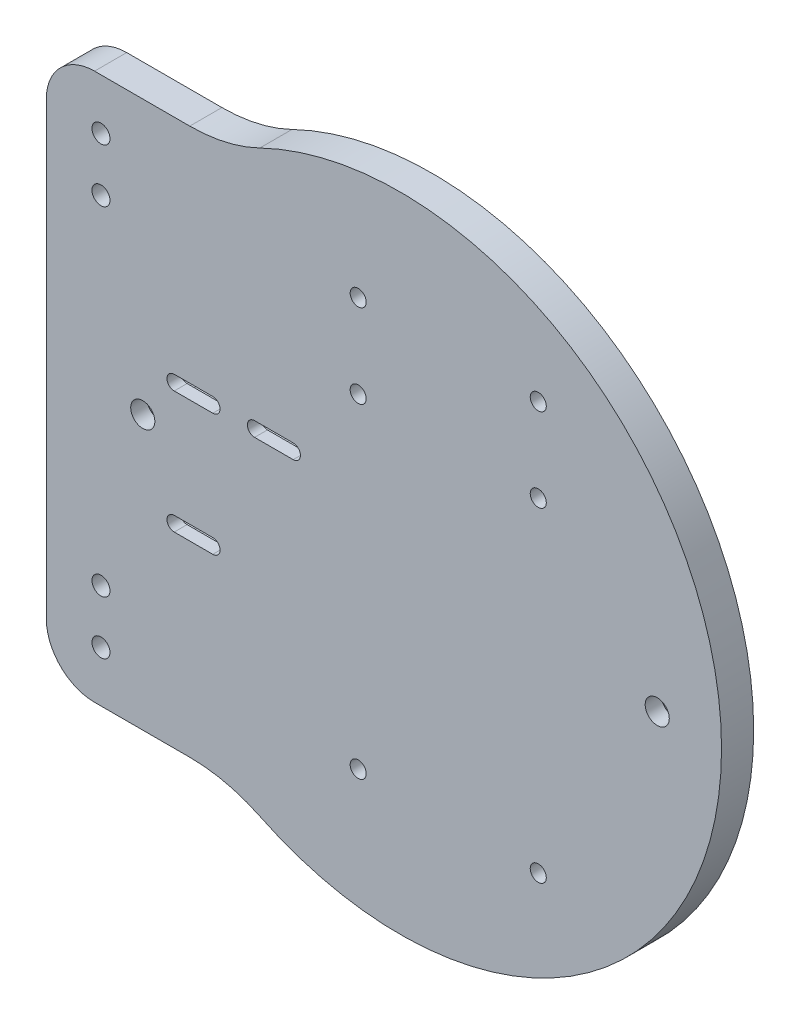
from build123d import *

# Parameters (mm, degrees)
SALIENTE_EXTRUIR2_DEPTH                              = 10
REDONDEO3_R                                          = 15
REDONDEO5_R                                          = 50
CROQUIS4_R                                           = 2.8
CROQUIS4_R_2                                         = 2.5
CORTAR_EXTRUIR1_DEPTH                                = 149.996644258
REFRENTADO_PARA_TORNILLO_CON_CABEZA_TRON_D           = 4.5
REFRENTADO_PARA_TORNILLO_CON_CABEZA_TRON_CBORE_D     = 7.5
REFRENTADO_PARA_TORNILLO_CON_CABEZA_TRON_CBORE_DEPTH = 5
CORTAR_EXTRUIR2_DEPTH                                = 6


with BuildPart() as part:
    # Croquis2 → Saliente-Extruir2 (new body)
    with BuildSketch(Plane(origin=(0, 0, 0), x_dir=(0, 1, 0), z_dir=(0, 0, 1))):
        with BuildLine():
            Line((-85, 52.678268764), (-85, 110))
            Line((-85, 110), (85, 110))
            Line((85, 110), (85, 52.678268764))
            ThreePointArc((85, 52.678268764), (0, -100), (-85, 52.678268764))
        make_face()
    extrude(amount=SALIENTE_EXTRUIR2_DEPTH)

    # Redondeo3
    redondeo3_edges = [part.edges().sort_by_distance(p)[0] for p in [
        (-110, 85, 5),
        (-110, -85, 5),
    ]]
    fillet(redondeo3_edges, radius=REDONDEO3_R)

    # Redondeo5
    redondeo5_edges = [part.edges().sort_by_distance(p)[0] for p in [
        (-52.678268764, 85, 5),
        (-52.678268764, -85, 5),
    ]]
    fillet(redondeo5_edges, radius=REDONDEO5_R)

    # Croquis4 → Cortar-Extruir1 (cut, through all)
    with BuildSketch(Plane.XY.offset(10)):
        with Locations((-93, 69.2)):
            Circle(CROQUIS4_R)
        with Locations((-93, 52.559880358)):
            Circle(CROQUIS4_R)
        with Locations((-93, -52.559880358)):
            Circle(CROQUIS4_R)
        with Locations((-93, -69.2)):
            Circle(CROQUIS4_R)
        with Locations((-13, 39)):
            Circle(CROQUIS4_R_2)
        with Locations((43, 39)):
            Circle(CROQUIS4_R_2)
        with Locations((-13, 65)):
            Circle(CROQUIS4_R_2)
        with Locations((43, 65)):
            Circle(CROQUIS4_R_2)
        with Locations((-13, -62)):
            Circle(CROQUIS4_R_2)
        with Locations((43, -62)):
            Circle(CROQUIS4_R_2)
        with BuildLine():
            Line((-58.219532094, 11.25), (-70.219532094, 11.25))
            ThreePointArc((-70.219532094, 11.25), (-72.469532094, 13.5), (-70.219532094, 15.75))
            Line((-70.219532094, 15.75), (-58.219532094, 15.75))
            ThreePointArc((-58.219532094, 15.75), (-55.969532094, 13.5), (-58.219532094, 11.25))
        make_face()
        with BuildLine():
            Line((-33.219532094, 11.25), (-45.219532094, 11.25))
            ThreePointArc((-45.219532094, 11.25), (-47.469532094, 13.5), (-45.219532094, 15.75))
            Line((-45.219532094, 15.75), (-33.219532094, 15.75))
            ThreePointArc((-33.219532094, 15.75), (-30.969532094, 13.5), (-33.219532094, 11.25))
        make_face()
        with BuildLine():
            Line((-58.219532094, -26.75), (-70.219532094, -26.75))
            ThreePointArc((-70.219532094, -26.75), (-72.469532094, -24.5), (-70.219532094, -22.25))
            Line((-70.219532094, -22.25), (-58.219532094, -22.25))
            ThreePointArc((-58.219532094, -22.25), (-55.969532094, -24.5), (-58.219532094, -26.75))
        make_face()
    extrude(amount=-CORTAR_EXTRUIR1_DEPTH, mode=Mode.SUBTRACT)

    # Refrentado para tornillo con cabeza troncocónica de M41 (through all)
    with Locations(Plane.XY.offset(10)):
        with Locations((-80, 0), (80, 0)):
            CounterBoreHole(REFRENTADO_PARA_TORNILLO_CON_CABEZA_TRON_D / 2, REFRENTADO_PARA_TORNILLO_CON_CABEZA_TRON_CBORE_D / 2, REFRENTADO_PARA_TORNILLO_CON_CABEZA_TRON_CBORE_DEPTH)

    # Croquis7 → Cortar-Extruir2 (cut)
    with BuildSketch(Plane(origin=(0, 0, 0), x_dir=(1, 0, 0), z_dir=(0, 0, -1))):
        with BuildLine():
            Line((-70.219532094, 29), (-58.219532094, 29))
            ThreePointArc((-58.219532094, 29), (-53.719532094, 24.5), (-58.219532094, 20))
            Line((-58.219532094, 20), (-70.219532094, 20))
            ThreePointArc((-70.219532094, 20), (-74.719532094, 24.5), (-70.219532094, 29))
        make_face()
        with BuildLine():
            Line((-70.219532094, -9), (-58.219532094, -9))
            ThreePointArc((-58.219532094, -9), (-53.719532094, -13.5), (-58.219532094, -18))
            Line((-58.219532094, -18), (-70.219532094, -18))
            ThreePointArc((-70.219532094, -18), (-74.719532094, -13.5), (-70.219532094, -9))
        make_face()
        with BuildLine():
            Line((-45.219532094, -9), (-33.219532094, -9))
            ThreePointArc((-33.219532094, -9), (-28.719532094, -13.5), (-33.219532094, -18))
            Line((-33.219532094, -18), (-45.219532094, -18))
            ThreePointArc((-45.219532094, -18), (-49.719532094, -13.5), (-45.219532094, -9))
        make_face()
    extrude(amount=-CORTAR_EXTRUIR2_DEPTH, mode=Mode.SUBTRACT)


solid = part.part
